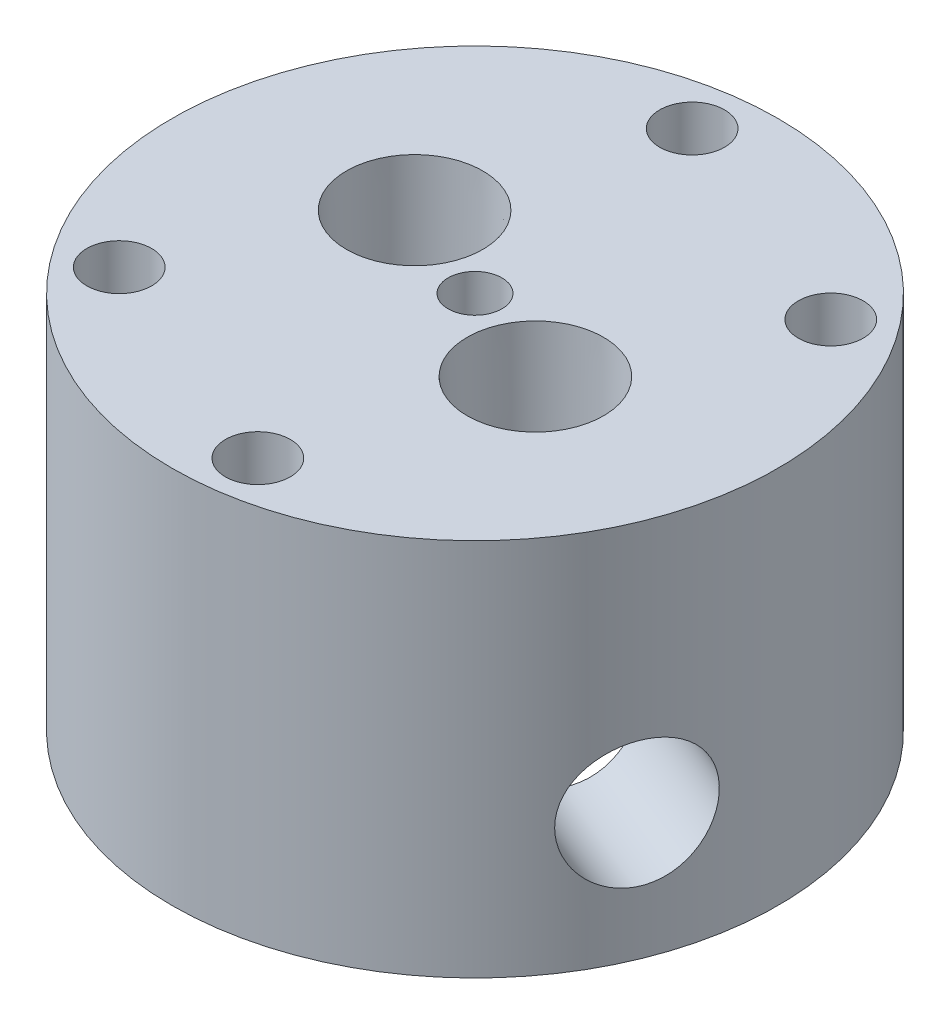
from build123d import *

# Parameters (mm, degrees)
SKETCH1_R                         = 30.48
BOSS_EXTRUDE1_DEPTH               = 25.4
SKETCH7_R                         = 11.43
CUT_EXTRUDE2_DEPTH                = 12.7
F_1_4_CLEARANCE_HOLE1_D           = 6.5278
F_1_4_28_TAPPED_HOLE1_D           = 5.4102
F_1_4_NPT_TAPPED_HOLE1_AT_2_COUNT = 2
F_1_4_NPT_TAPPED_HOLE1_AT_2_PITCH = 22.225
SKETCH13_R                        = 17.145
CUT_EXTRUDE3_DEPTH                = 12.7
MOVE_FACE1_BY                     = 12.7
CUT_EXTRUDE4_DEPTH                = 51.032197633
CUT_EXTRUDE4_DEPTH_BACK           = 51.032197633
SKETCH17_R                        = 6.35


with BuildPart() as part:
    # Sketch1 → Boss-Extrude1 (new body)
    with BuildSketch(Plane(origin=(0, 0, 0), x_dir=(1, 0, 0), z_dir=(0, 1, 0))):
        with Locations(Location((0, 0, 0), (0, 0, 270))):
            Circle(SKETCH1_R)
    extrude(amount=BOSS_EXTRUDE1_DEPTH)

    # Sketch7 → Cut-Extrude2 (cut)
    with BuildSketch(Plane.XZ):
        with Locations(Location((0, 0, 0), (0, 0, 270))):
            Circle(SKETCH7_R)
    extrude(amount=-CUT_EXTRUDE2_DEPTH, mode=Mode.SUBTRACT)

    # 1/4 Clearance Hole1 (through all)
    with Locations(Plane(origin=(0, 25.4, 0), x_dir=(1, 0, 0), z_dir=(0, 1, 0))):
        with Locations((20.175514493, 15.615257641), (3.435452557, -25.280136906), (-3.435452557, 25.280136906), (-20.175514493, -15.615257641)):
            Hole(F_1_4_CLEARANCE_HOLE1_D / 2)

    # 1/4-28 Tapped Hole1 (through all)
    with Locations(Plane(origin=(0, 25.4, 0), x_dir=(1, 0, 0), z_dir=(0, 1, 0))):
        with Locations((0, 0)):
            Hole(F_1_4_28_TAPPED_HOLE1_D / 2)

    # Sketch12 → 1/4 NPT Tapped Hole1 (revolve, cut)
    with BuildSketch(Plane(origin=(-10.284247774, 25.4, -4.20973918), x_dir=(0, 0, 1), z_dir=(1, 0, 0))):
        Polygon((0, 0), (0, 25.4), (5.5626, 25.4), (5.5626, 9.906), (6.557984794, 9.906), (6.8545837, 0), align=None)
    f_1_4_npt_tapped_hole1 = revolve(axis=Axis((-10.284247774, 31.75, -4.20973918), (0, -1, 0)), mode=Mode.SUBTRACT)

    # 1/4 NPT Tapped Hole1 at 2: 1/4 NPT Tapped Hole1 ×2
    with Locations(*[Vector(0.9254666163685323, 0, 0.3788291725664483) * (i * F_1_4_NPT_TAPPED_HOLE1_AT_2_PITCH) for i in range(1, F_1_4_NPT_TAPPED_HOLE1_AT_2_COUNT)]):
        add(f_1_4_npt_tapped_hole1, mode=Mode.SUBTRACT)

    # Sketch13 → Cut-Extrude3 (cut)
    with BuildSketch(Plane.XZ):
        with Locations(Location((0, 0, 0), (0, 0, 270))):
            Circle(SKETCH13_R)
    extrude(amount=-CUT_EXTRUDE3_DEPTH, mode=Mode.SUBTRACT)

    # Move Face1: a face moved outward by 12.7
    extrude(part.faces().sort_by_distance((0, 0, 24.384))[0], amount=MOVE_FACE1_BY, dir=(0, -1, 0))

    # Sketch17 → Cut-Extrude4 (cut, two sides: drawn at the far end of the back side and taken through both)
    with BuildSketch(Plane(origin=(0, 0, 0), x_dir=(-0.37882917256642434, 0, 0.9254666163685421), z_dir=(-0.9254666163685421, 0, -0.37882917256642434)).offset(-CUT_EXTRUDE4_DEPTH_BACK)):
        Circle(SKETCH17_R)
    extrude(amount=CUT_EXTRUDE4_DEPTH + CUT_EXTRUDE4_DEPTH_BACK, mode=Mode.SUBTRACT)


solid = part.part
